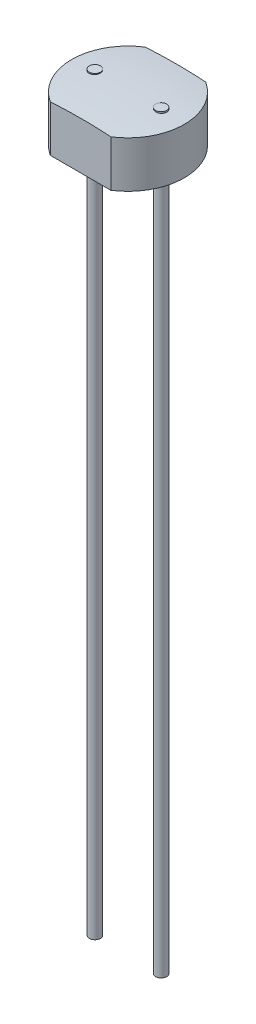
from build123d import *

# Parameters (mm, degrees)
BOSS_EXTRU_1_DEPTH      = 2.1
ESQUISSE3_W             = 2.74226184
ESQUISSE3_H             = 0.472482842
ENL_V_MAT_EXTRU_1_DEPTH = 2.1
ESQUISSE5_R             = 0.25
BOSS_EXTRU_2_DEPTH      = 34


with BuildPart() as part:
    # Esquisse1 → Boss.-Extru.1 (new body)
    with BuildSketch(Plane(origin=(0, 0, 0), x_dir=(1, 0, 0), z_dir=(0, 1, 0))):
        with BuildLine():
            Line((-1.37113092, -2.15), (1.37113092, -2.15))
            ThreePointArc((1.37113092, -2.15), (2.55, 0), (1.37113092, 2.15))
            Line((1.37113092, 2.15), (-1.37113092, 2.15))
            ThreePointArc((-1.37113092, 2.15), (-2.55, 0), (-1.37113092, -2.15))
        make_face()
    extrude(amount=BOSS_EXTRU_1_DEPTH)

    # Esquisse2 → Révolution1 (revolve)
    with BuildSketch(Plane.XY):
        with BuildLine():
            Line((0, 2.1), (0, 2.25))
            ThreePointArc((0, 2.25), (-1.277203977, 2.212467617), (-2.55, 2.1))
            Line((-2.55, 2.1), (0, 2.1))
        make_face()
    revolve(axis=Axis((0, 2.1, 0), (0, 1, 0)))

    # Esquisse3 → Enlèv. mat.-Extru.1 (cut)
    with BuildSketch(Plane.XZ.offset(-2.1)):
        with Locations((0, -2.386241421)):
            Rectangle(ESQUISSE3_W, ESQUISSE3_H)
        Polygon((-1.37113092, 2.15), (-1.37113092, 2.636321801), (1.307781681, 2.636321801), (1.37113092, 2.15), align=None)
    extrude(amount=-ENL_V_MAT_EXTRU_1_DEPTH, mode=Mode.SUBTRACT)

    # Esquisse5 → Boss.-Extru.2 (add)
    with BuildSketch(Plane(origin=(0, 2.25, 0), x_dir=(1, 0, 0), z_dir=(0, 1, 0))):
        with Locations(Location((-1.5, 0, 0), (0, 0, 270))):
            Circle(ESQUISSE5_R)
        with Locations(Location((1.5, 0, 0), (0, 0, 270))):
            Circle(ESQUISSE5_R)
    extrude(amount=-BOSS_EXTRU_2_DEPTH)


solid = part.part
